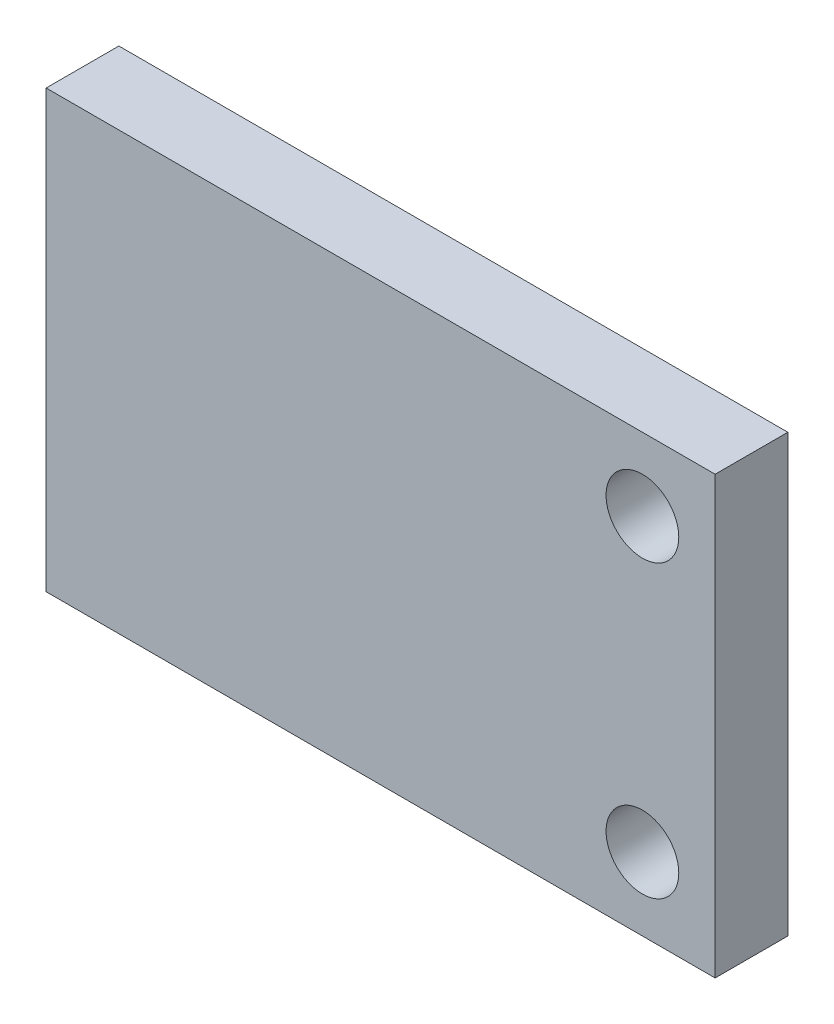
from build123d import *

# Parameters (mm, degrees)
SZKIC1_W                    = 92
SZKIC1_H                    = 60
SZKIC1_R                    = 5
DODANIE_WYCI_GNI_CIE1_DEPTH = 10


with BuildPart() as part:
    # Szkic1 → Dodanie-wyciągnięcie1 (new body)
    with BuildSketch(Plane.XY):
        Rectangle(SZKIC1_W, SZKIC1_H)
        with Locations((36, -20)):
            Circle(SZKIC1_R, mode=Mode.SUBTRACT)
        with Locations((36, 20)):
            Circle(SZKIC1_R, mode=Mode.SUBTRACT)
    extrude(amount=DODANIE_WYCI_GNI_CIE1_DEPTH)


solid = part.part
